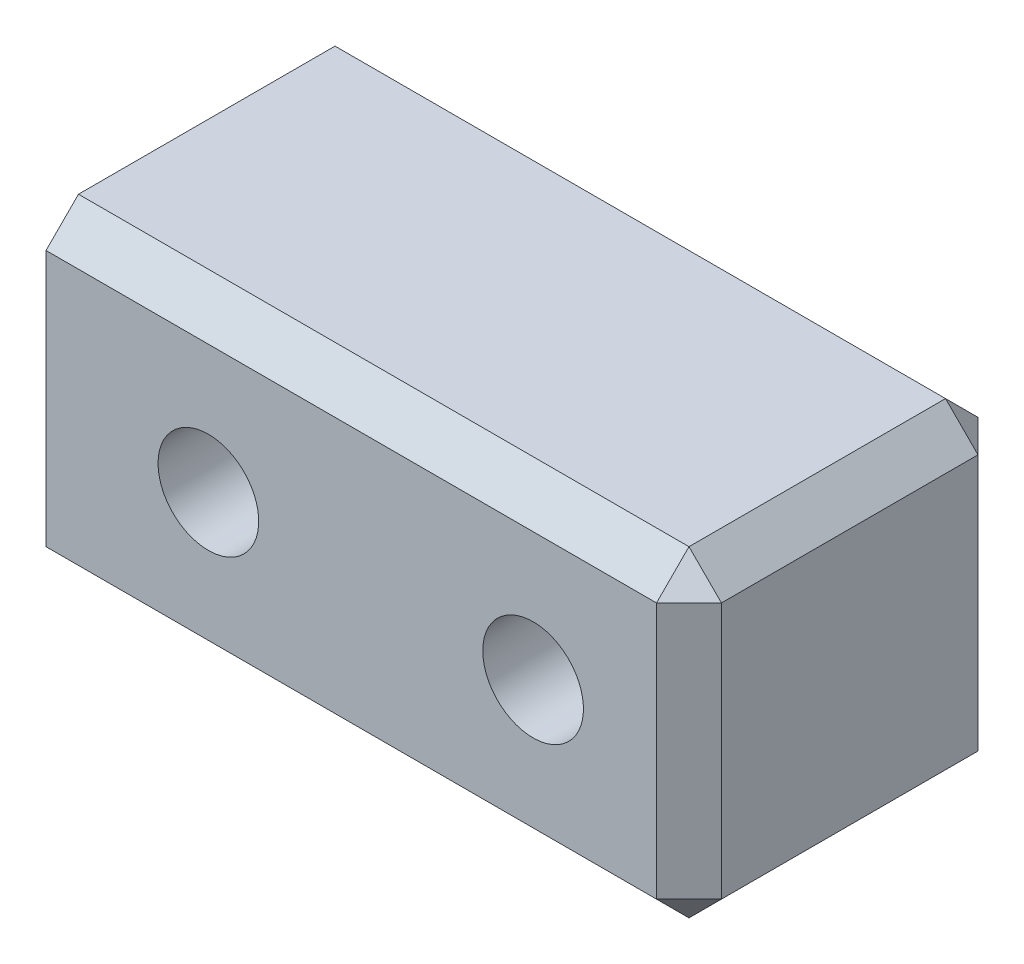
from build123d import *

# Parameters (mm, degrees)
SKETCH_1_W      = 19.8
SKETCH_1_H      = 9.9
SKETCH_1_R      = 1.55
EXTRUDE_1_DEPTH = 9.9
CHAMFER_1_SIZE  = 1


with BuildPart() as part:
    # 草图1 → 凸台-拉伸1 (new body)
    with BuildSketch(Plane.XY):
        with Locations((9.9, 4.95)):
            Rectangle(SKETCH_1_W, SKETCH_1_H)
        with Locations(Location((5, 4.95, 0), (0, 0, 180))):
            Circle(SKETCH_1_R, mode=Mode.SUBTRACT)
        with Locations(Location((15, 4.95, 0), (0, 0, 180))):
            Circle(SKETCH_1_R, mode=Mode.SUBTRACT)
    extrude(amount=EXTRUDE_1_DEPTH)

    # 倒角1
    chamfer_1_edges = [part.edges().sort_by_distance(p)[0] for p in [
        (19.8, 4.95, 9.9),
        (9.9, 9.9, 9.9),
        (9.9, 9.9, 0),
        (19.8, 4.95, 0),
        (9.9, 0, 0),
        (19.8, 9.9, 4.95),
        (19.8, 0, 4.95),
        (9.9, 0, 9.9),
    ]]
    chamfer(chamfer_1_edges, length=CHAMFER_1_SIZE)


solid = part.part
